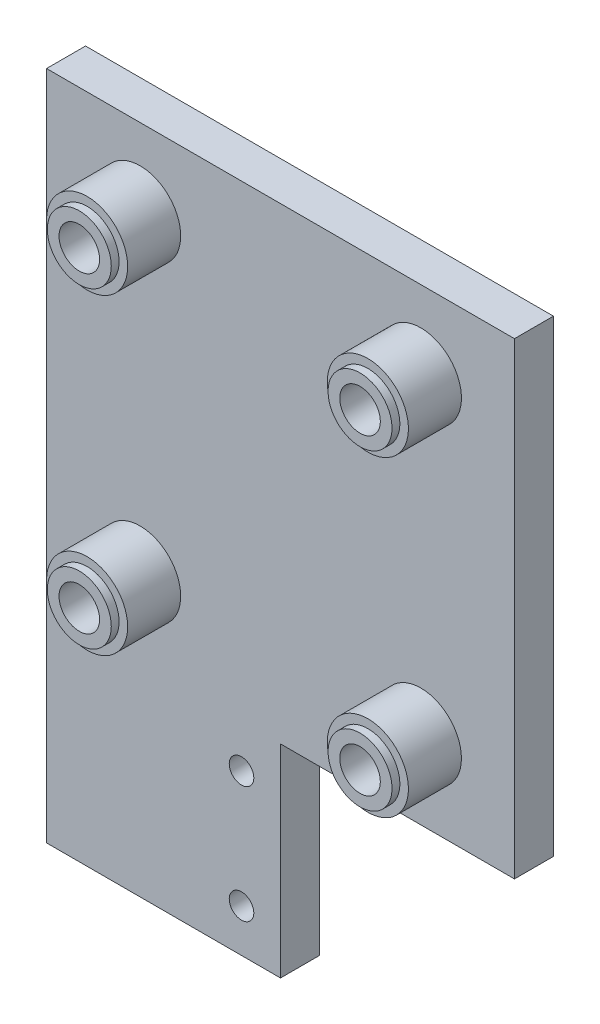
from build123d import *

# Parameters (mm, degrees)
SKETCH1_W           = 38.1
SKETCH1_H           = 76.2
BOSS_EXTRUDE1_DEPTH = 6.35
SKETCH8_W           = 19.05
SKETCH8_H           = 76.2
BOSS_EXTRUDE5_DEPTH = 6.35
SKETCH5_R           = 6.604
BOSS_EXTRUDE2_DEPTH = 9.906
SKETCH6_R           = 3.302
CUT_EXTRUDE3_DEPTH  = 57.280347689
CUT_EXTRUDE4_START  = -1.27
SKETCH9_R           = 6.604
SKETCH9_R_2         = 5.207
CUT_EXTRUDE4_DEPTH  = 1.27
SKETCH11_W          = 38.1
SKETCH11_H          = 33.02
SKETCH11_R          = 2
BOSS_EXTRUDE6_DEPTH = 6.35


with BuildPart() as part:
    # Sketch1 → Boss-Extrude1 (new body)
    with BuildSketch(Plane.XY):
        Rectangle(SKETCH1_W, SKETCH1_H)
    extrude(amount=BOSS_EXTRUDE1_DEPTH)

    # Sketch8 → Boss-Extrude5 (add)
    with BuildSketch(Plane.XY.offset(6.35)):
        with Locations((-28.575, 0)):
            Rectangle(SKETCH8_W, SKETCH8_H)
        with Locations((28.575, 0)):
            Rectangle(SKETCH8_W, SKETCH8_H)
    extrude(amount=-BOSS_EXTRUDE5_DEPTH)

    # Sketch5 → Boss-Extrude2 (add)
    with BuildSketch(Plane.XY.offset(6.35)):
        with Locations(Location((22.86, 25.4, 0), (0, 0, 180))):
            Circle(SKETCH5_R)
        with Locations(Location((-22.86, 25.4, 0), (0, 0, 180))):
            Circle(SKETCH5_R)
    boss_extrude2 = extrude(amount=BOSS_EXTRUDE2_DEPTH)

    # Sketch6 → Cut-Extrude3 (cut, through all)
    with BuildSketch(Plane.XY.offset(16.256)):
        with Locations((22.86, 25.4)):
            Circle(SKETCH6_R)
        with Locations(Location((-22.86, 25.4, 0), (0, 0, 180))):
            Circle(SKETCH6_R)
    cut_extrude3 = extrude(amount=-CUT_EXTRUDE3_DEPTH, mode=Mode.SUBTRACT)

    # Sketch9 → Cut-Extrude4 (cut)
    # profile 1 of 2: a face of its own
    with BuildSketch(Plane.XY.offset(16.256).offset(CUT_EXTRUDE4_START)):
        with Locations(Location((-22.86, 25.4, 0), (0, 0, 180))):
            Circle(SKETCH9_R)
        with Locations((-22.86, 25.4)):
            Circle(SKETCH9_R_2, mode=Mode.SUBTRACT)
    # profile 2 of 2: a face of its own
    with BuildSketch(Plane.XY.offset(16.256).offset(CUT_EXTRUDE4_START)):
        with Locations(Location((22.86, 25.4, 0), (0, 0, 180))):
            Circle(SKETCH9_R)
        with Locations(Location((22.86, 25.4, 0), (0, 0, 180))):
            Circle(SKETCH9_R_2, mode=Mode.SUBTRACT)
    cut_extrude4 = extrude(amount=CUT_EXTRUDE4_DEPTH, mode=Mode.SUBTRACT)

    # Mirror1: Boss-Extrude2, Cut-Extrude3, Cut-Extrude4 across plane
    add(boss_extrude2.mirror(Plane.ZX))
    add(cut_extrude3.mirror(Plane.ZX), mode=Mode.SUBTRACT)
    add(cut_extrude4.mirror(Plane.ZX), mode=Mode.SUBTRACT)

    # Sketch11 → Boss-Extrude6 (add)
    with BuildSketch(Plane(origin=(0, 0, 0), x_dir=(-1, 0, 0), z_dir=(0, 0, -1))):
        with Locations((19.05, -54.61)):
            Rectangle(SKETCH11_W, SKETCH11_H)
        with Locations((6.35, -64.135)):
            Circle(SKETCH11_R, mode=Mode.SUBTRACT)
        with Locations((6.35, -45.085)):
            Circle(SKETCH11_R, mode=Mode.SUBTRACT)
    extrude(amount=-BOSS_EXTRUDE6_DEPTH)


solid = part.part
